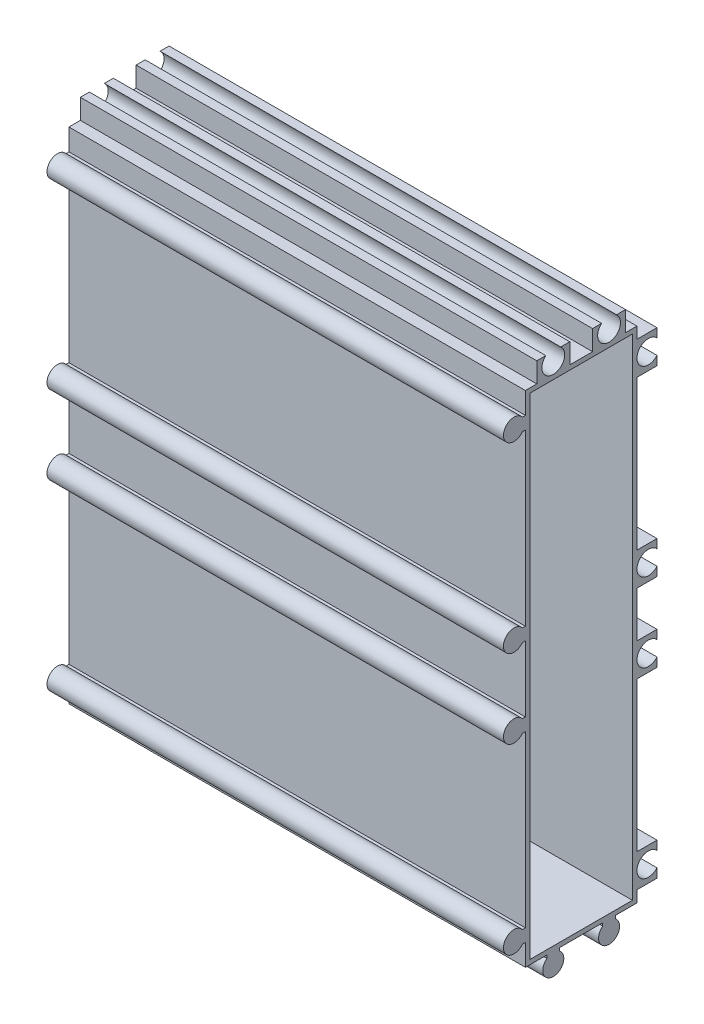
from build123d import *

# Parameters (mm, degrees)
EXTRUDE_1_DEPTH             = 90
SKETCH_2_W                  = 90
SKETCH_2_H                  = 17.75
EXTRUDE_2_DEPTH             = 8.2
SKETCH_3_W                  = 90
SKETCH_3_H                  = 102.45
EXTRUDE_3_DEPTH             = 8.2
SKETCH_4_W                  = 3.95
SKETCH_4_H                  = 2.25
CUT_EXTRUDE_1_DEPTH         = 171.45954982
SKETCH_5_W                  = 3.95
SKETCH_5_H                  = 29.5
CUT_EXTRUDE_2_DEPTH         = 171.45954982
SKETCH_6_W                  = 3.95
SKETCH_6_H                  = 9
CUT_EXTRUDE_3_DEPTH         = 171.45954982
SKETCH_7_W                  = 3.95
SKETCH_7_H                  = 29.5
CUT_EXTRUDE_4_DEPTH         = 171.45954982
SKETCH_8_W                  = 3.95
SKETCH_8_H                  = 6.2
CUT_EXTRUDE_5_DEPTH         = 171.45954982
SKETCH_9_W                  = 2.25
SKETCH_9_H                  = 3.95
CUT_EXTRUDE_6_DEPTH         = 171.45954982
SKETCH_10_W                 = 4.5
SKETCH_10_H                 = 3.95
CUT_EXTRUDE_7_DEPTH         = 171.45954982
SKETCH_11_W                 = 2.25
SKETCH_11_H                 = 3.95
CUT_EXTRUDE_8_DEPTH         = 171.45954982
SKETCH_12_W                 = 20.2
SKETCH_12_H                 = 96.7
CUT_EXTRUDE_9_DEPTH         = 86
HOLE_WIZARD_8_3_8_3_1_D     = 8.3
HOLE_WIZARD_8_3_8_3_1_DEPTH = 3.2
HOLE_WIZARD_4_5_4_5_1_D     = 4.5
HOLE_WIZARD_2_5_2_5_1_D     = 2.5
SKETCH_19_R                 = 4.5030807
EXTRUDE_4_DEPTH             = 3
SKETCH_20_R                 = 1.649948342
SKETCH_20_R_2               = 1.660581376
SKETCH_20_R_3               = 1.430745594
SKETCH_20_R_4               = 1.573250385
SKETCH_20_R_5               = 1.502029841
SKETCH_20_R_6               = 1.53795619
EXTRUDE_5_DEPTH             = 90


with BuildPart() as part:
    # Эскиз1 → Бобышка-Вытянуть1 (new body)
    with BuildSketch(Plane(origin=(90, 0, 0), x_dir=(0, 0, -1), z_dir=(1, 0, 0))):
        with BuildLine():
            Line((6.75, 40.906238208), (6.75, 135.75))
            Line((6.75, 135.75), (-11.593761792, 135.75))
            ThreePointArc((-11.593761792, 135.75), (-15.325, 134.5), (-11.593761793, 133.25))
            Line((-11.593761793, 133.25), (-11, 133.25))
            Line((-11, 133.25), (-11, 99.75))
            Line((-11, 99.75), (-11.593761792, 99.75))
            ThreePointArc((-11.593761792, 99.75), (-15.325, 98.5), (-11.593761792, 97.25))
            Line((-11.593761792, 97.25), (-11, 97.25))
            Line((-11, 97.25), (-11, 84.25))
            Line((-11, 84.25), (-11.593761792, 84.25))
            ThreePointArc((-11.593761792, 84.25), (-15.325, 83), (-11.593761792, 81.75))
            Line((-11.593761792, 81.75), (-11, 81.75))
            Line((-11, 81.75), (-11, 48.25))
            Line((-11, 48.25), (-11.593761792, 48.25))
            ThreePointArc((-11.593761792, 48.25), (-15.325, 47), (-11.593761792, 45.75))
            Line((-11.593761792, 45.75), (-11, 45.75))
            Line((-11, 45.75), (-11, 41.5))
            Line((-11, 41.5), (-6.75, 41.5))
            Line((-6.75, 41.5), (-6.75, 40.906238208))
            ThreePointArc((-6.75, 40.906238208), (-5.5, 37.175), (-4.25, 40.906238208))
            Line((-4.25, 40.906238208), (-4.25, 41.5))
            Line((-4.25, 41.5), (4.25, 41.5))
            Line((4.25, 41.5), (4.25, 40.906238208))
            ThreePointArc((4.25, 40.906238208), (5.5, 37.175), (6.75, 40.906238208))
        make_face()
    extrude(amount=-EXTRUDE_1_DEPTH)

    # Эскиз2 → Бобышка-Вытянуть2 (add)
    with BuildSketch(Plane(origin=(0, 135.75, 0), x_dir=(-1, 0, 0), z_dir=(0, 1, 0))):
        with Locations((-45, 2.125)):
            Rectangle(SKETCH_2_W, SKETCH_2_H)
    extrude(amount=EXTRUDE_2_DEPTH)

    # Эскиз3 → Бобышка-Вытянуть3 (add)
    with BuildSketch(Plane(origin=(0, 0, -6.75), x_dir=(-1, 0, 0), z_dir=(0, 0, -1))):
        with Locations((-45, 92.725)):
            Rectangle(SKETCH_3_W, SKETCH_3_H)
    extrude(amount=EXTRUDE_3_DEPTH)

    # Эскиз4 → Вырез-Вытянуть1 (cut, through all)
    with BuildSketch(Plane.ZY):
        with Locations((-12.975, 42.625)):
            Rectangle(SKETCH_4_W, SKETCH_4_H)
    extrude(amount=-CUT_EXTRUDE_1_DEPTH, mode=Mode.SUBTRACT)

    # Эскиз5 → Вырез-Вытянуть2 (cut, through all)
    with BuildSketch(Plane.ZY):
        with Locations((-12.975, 65)):
            Rectangle(SKETCH_5_W, SKETCH_5_H)
    extrude(amount=-CUT_EXTRUDE_2_DEPTH, mode=Mode.SUBTRACT)

    # Эскиз6 → Вырез-Вытянуть3 (cut, through all)
    with BuildSketch(Plane.ZY):
        with Locations((-12.975, 90.75)):
            Rectangle(SKETCH_6_W, SKETCH_6_H)
    extrude(amount=-CUT_EXTRUDE_3_DEPTH, mode=Mode.SUBTRACT)

    # Эскиз7 → Вырез-Вытянуть4 (cut, through all)
    with BuildSketch(Plane.ZY):
        with Locations((-12.975, 116.5)):
            Rectangle(SKETCH_7_W, SKETCH_7_H)
    extrude(amount=-CUT_EXTRUDE_4_DEPTH, mode=Mode.SUBTRACT)

    # Эскиз8 → Вырез-Вытянуть5 (cut, through all)
    with BuildSketch(Plane.ZY):
        with Locations((-12.975, 140.85)):
            Rectangle(SKETCH_8_W, SKETCH_8_H)
    extrude(amount=-CUT_EXTRUDE_5_DEPTH, mode=Mode.SUBTRACT)

    # Эскиз9 → Вырез-Вытянуть6 (cut, through all)
    with BuildSketch(Plane.ZY):
        with Locations((-9.875, 141.975)):
            Rectangle(SKETCH_9_W, SKETCH_9_H)
    extrude(amount=-CUT_EXTRUDE_6_DEPTH, mode=Mode.SUBTRACT)

    # Эскиз10 → Вырез-Вытянуть7 (cut, through all)
    with BuildSketch(Plane.ZY):
        with Locations((0, 141.975)):
            Rectangle(SKETCH_10_W, SKETCH_10_H)
    extrude(amount=-CUT_EXTRUDE_7_DEPTH, mode=Mode.SUBTRACT)

    # Эскиз11 → Вырез-Вытянуть8 (cut, through all)
    with BuildSketch(Plane.ZY):
        with Locations((9.875, 141.975)):
            Rectangle(SKETCH_11_W, SKETCH_11_H)
    extrude(amount=-CUT_EXTRUDE_8_DEPTH, mode=Mode.SUBTRACT)

    # Эскиз12 → Вырез-Вытянуть9 (cut)
    with BuildSketch(Plane(origin=(90, 0, 0), x_dir=(0, 0, -1), z_dir=(1, 0, 0))):
        with Locations((0, 90.75)):
            Rectangle(SKETCH_12_W, SKETCH_12_H)
    extrude(amount=-CUT_EXTRUDE_9_DEPTH, mode=Mode.SUBTRACT)

    # Диаметр отверстия Ø8.3 (8.3)1
    with Locations(Plane.ZY):
        with Locations((0, 90)):
            Hole(HOLE_WIZARD_8_3_8_3_1_D / 2, depth=HOLE_WIZARD_8_3_8_3_1_DEPTH)

    # Диаметр отверстия Ø4.5 (4.5)1 (through all)
    with Locations(Plane.ZY):
        with Locations((-13.25, 47), (-13.25, 83), (-13.25, 98.5), (-13.25, 134.5), (-5.5, 142.25), (5.5, 142.25)):
            Hole(HOLE_WIZARD_4_5_4_5_1_D / 2)

    # Диаметр отверстия Ø2.5 (2.5)1 (through all)
    with Locations(Plane(origin=(90, 0, 0), x_dir=(0, 0, -1), z_dir=(1, 0, 0))):
        with Locations((-13.25, 98.5), (-13.25, 134.5), (-13.25, 47), (-13.25, 83), (5.5, 39.25), (-5.5, 39.25)):
            Hole(HOLE_WIZARD_2_5_2_5_1_D / 2)

    # Эскиз19 → Бобышка-Вытянуть4 (add)
    with BuildSketch(Plane.ZY):
        with Locations((0, 90)):
            Circle(SKETCH_19_R)
    extrude(amount=-EXTRUDE_4_DEPTH)

    # Эскиз20 → Бобышка-Вытянуть5 (add)
    with BuildSketch(Plane(origin=(90, 0, 0), x_dir=(0, 0, -1), z_dir=(1, 0, 0))):
        with Locations((-13.25, 134.5)):
            Circle(SKETCH_20_R)
        with Locations((-13.25, 98.5)):
            Circle(SKETCH_20_R_2)
        with Locations((-13.25, 83)):
            Circle(SKETCH_20_R_3)
        with Locations((-13.25, 47)):
            Circle(SKETCH_20_R_4)
        with Locations((-5.5, 39.25)):
            Circle(SKETCH_20_R_5)
        with Locations((5.5, 39.25)):
            Circle(SKETCH_20_R_6)
    extrude(amount=-EXTRUDE_5_DEPTH)


solid = part.part
